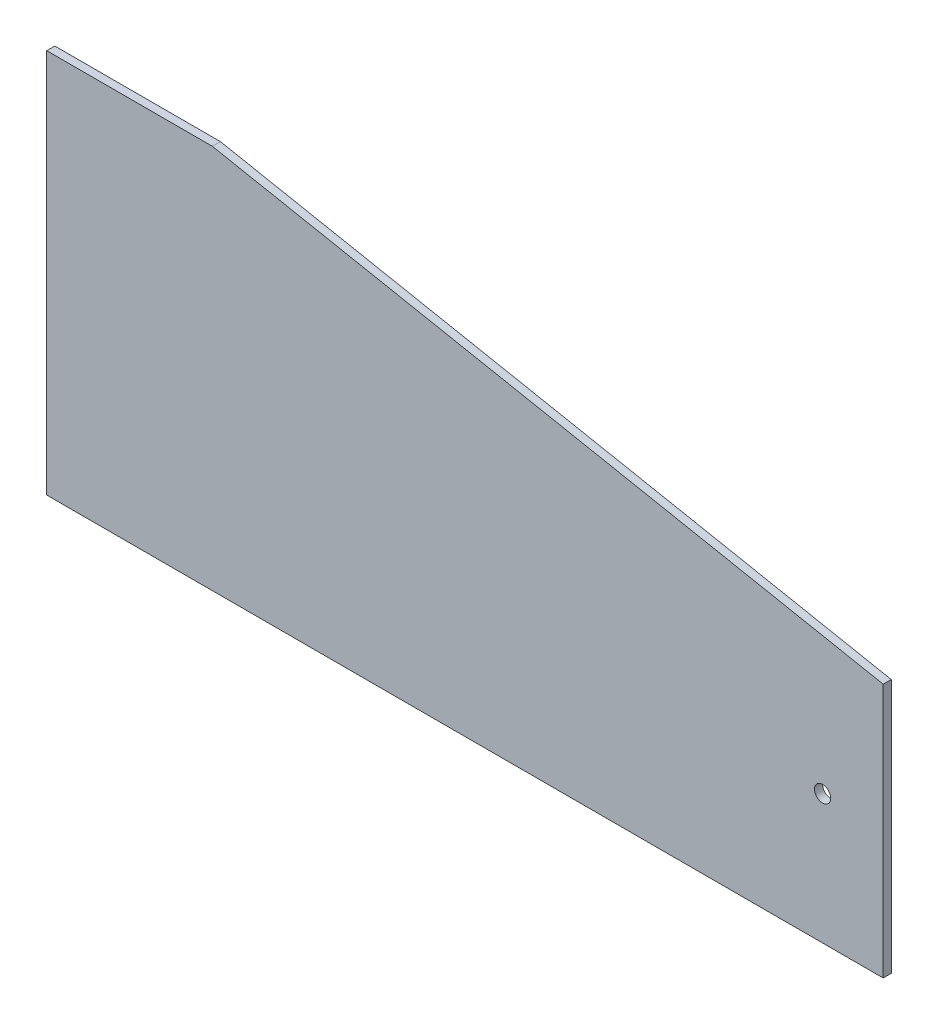
from build123d import *

# Parameters (mm, degrees)
BOSS_EXTRUDE1_DEPTH = 12.7
SKETCH2_R           = 12.7
CUT_EXTRUDE1_DEPTH  = 203.2


with BuildPart() as part:
    # Sketch1 → Boss-Extrude1 (new body)
    with BuildSketch(Plane.XY):
        Polygon((0, 0), (0, 605), (260.366426726, 605), (1315, 400), (1315, 0), align=None)
    extrude(amount=BOSS_EXTRUDE1_DEPTH)

    # Sketch2 → Cut-Extrude1 (cut)
    with BuildSketch(Plane(origin=(0, 0, 0), x_dir=(-1, 0, 0), z_dir=(0, 0, -1))):
        with Locations((-1219.75, 203.2)):
            Circle(SKETCH2_R)
    extrude(amount=-CUT_EXTRUDE1_DEPTH, mode=Mode.SUBTRACT)


solid = part.part
